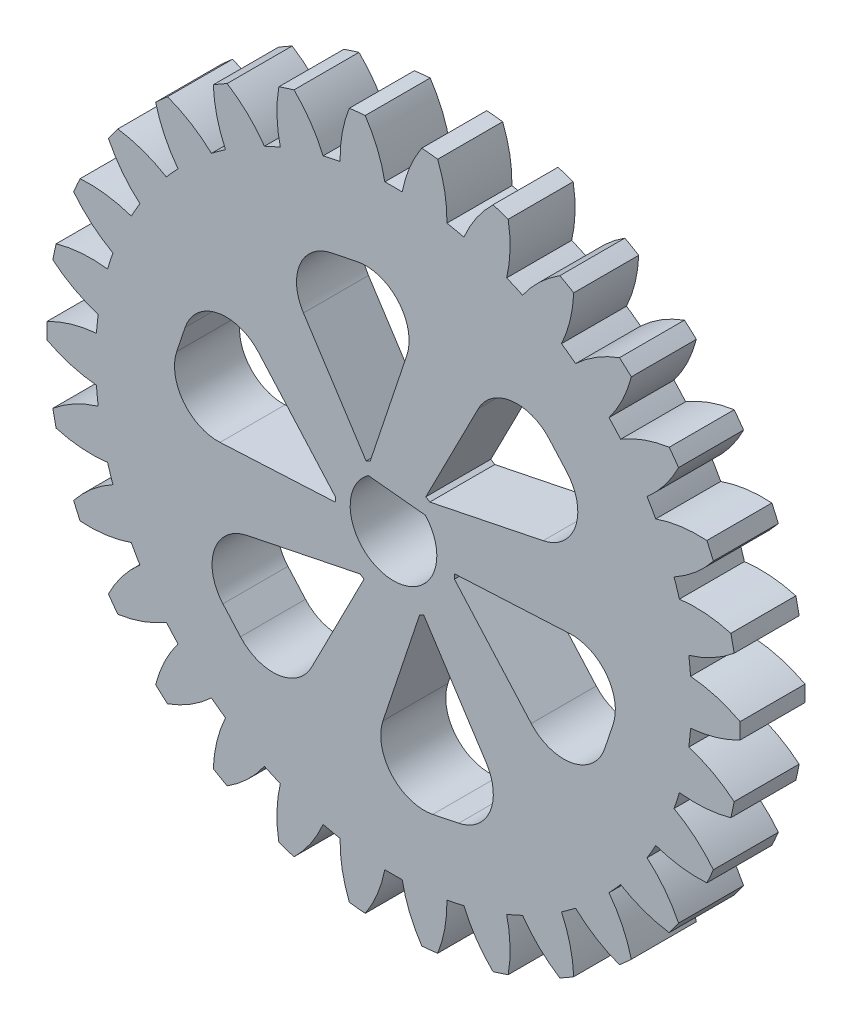
from build123d import *

# Parameters (mm, degrees)
SKETCH1_R                = 16
BOSS_EXTRUDE1_DEPTH      = 3
CUT_EXTRUDE1_START       = -10
CUT_EXTRUDE1_DEPTH       = 10
CIRPATTERN1_COUNT        = 30
CUT_EXTRUDE2_DEPTH       = 10
FILLET7_R                = 2
FILLET8_R                = 2
CIRPATTERN4_COUNT        = 6
FILLET7_OF_CIRPATTERN4_R = 2
FILLET8_OF_CIRPATTERN4_R = 2
CUT_EXTRUDE3_DEPTH       = 10


with BuildPart() as part:
    # Sketch1 → Boss-Extrude1 (new body)
    with BuildSketch(Plane.XY):
        Circle(SKETCH1_R)
    extrude(amount=BOSS_EXTRUDE1_DEPTH)

    # Sketch2 → Cut-Extrude1 (cut)
    with BuildSketch(Plane.XY.offset(3).offset(CUT_EXTRUDE1_START)):
        with BuildLine():
            ThreePointArc((-1.305366692, 15.946661651), (-0.74298613, 14.890695411), (-0.40129344, 13.744142883))
            ThreePointArc((-0.40129344, 13.744142883), (0, 13.75), (0.40129344, 13.744142883))
            ThreePointArc((0.40129344, 13.744142883), (0.74298613, 14.890695411), (1.305366692, 15.946661651))
            ThreePointArc((1.305366692, 15.946661651), (0, 16), (-1.305366692, 15.946661651))
        make_face()
    cut_extrude1 = extrude(amount=CUT_EXTRUDE1_DEPTH, mode=Mode.SUBTRACT)

    # CirPattern1: Cut-Extrude1 ×30 about axis
    cirpattern1_axis = Axis((0, 0, 0), (0, 0, 1))
    for i in range(1, CIRPATTERN1_COUNT):
        add(cut_extrude1.rotate(cirpattern1_axis, i * 360 / CIRPATTERN1_COUNT), mode=Mode.SUBTRACT)

    # Sketch3 → Cut-Extrude2 (cut)
    with BuildSketch(Plane(origin=(0, 0, 0), x_dir=(-1, 0, 0), z_dir=(0, 0, -1))):
        Polygon((1.071334311, 2.258814467), (1.263717018, 2.157085835), (5.74546898, 9.085817861), (-1.712361732, 10.612743156), align=None)
    cut_extrude2 = extrude(amount=-CUT_EXTRUDE2_DEPTH, mode=Mode.SUBTRACT)

    # Fillet7
    fillet7_edges = [part.edges().sort_by_distance(p)[0] for p in [
        (1.712361732, 10.612743156, 1.5),
    ]]
    fillet(fillet7_edges, radius=FILLET7_R)

    # Fillet8
    fillet8_edges = [part.edges().sort_by_distance(p)[0] for p in [
        (-5.74546898, 9.085817861, 1.5),
    ]]
    fillet(fillet8_edges, radius=FILLET8_R)

    # CirPattern4: Cut-Extrude2 ×6 about axis
    cirpattern4_axis = Axis((0.065551526, -0.256388388, 0), (0, 0, 1))
    for i in range(1, CIRPATTERN4_COUNT):
        add(cut_extrude2.rotate(cirpattern4_axis, i * 360 / CIRPATTERN4_COUNT), mode=Mode.SUBTRACT)

    # Fillet7 of CirPattern4
    fillet7_of_cirpattern4_edges = [part.edges().sort_by_distance(p)[0] for p in [
        (-8.523987405, 6.604356858, 1.5),
        (-10.170797612, -4.264774685, 1.5),
        (-1.581258681, -11.125519931, 1.5),
        (8.655090456, -7.117133634, 1.5),
        (10.301900663, 3.75199791, 1.5),
    ]]
    fillet(fillet7_of_cirpattern4_edges, radius=FILLET7_OF_CIRPATTERN4_R)

    # Fillet8 of CirPattern4
    fillet8_of_cirpattern4_edges = [part.edges().sort_by_distance(p)[0] for p in [
        (-10.930546666, -0.617776644, 1.5),
        (-5.11952616, -9.959982892, 1.5),
        (5.876572032, -9.598594636, 1.5),
        (11.061649717, 0.104999868, 1.5),
        (5.250629211, 9.447206117, 1.5),
    ]]
    fillet(fillet8_of_cirpattern4_edges, radius=FILLET8_OF_CIRPATTERN4_R)

    # Sketch4 → Cut-Extrude3 (cut)
    with BuildSketch(Plane(origin=(0, 0, 0), x_dir=(-1, 0, 0), z_dir=(0, 0, -1))):
        with BuildLine():
            Line((-1.468124062, 1.358164842), (1.163996896, 1.626379791))
            ThreePointArc((1.163996896, 1.626379791), (0.202751444, -1.989696422), (-1.468124062, 1.358164842))
        make_face()
    extrude(amount=-CUT_EXTRUDE3_DEPTH, mode=Mode.SUBTRACT)


solid = part.part
